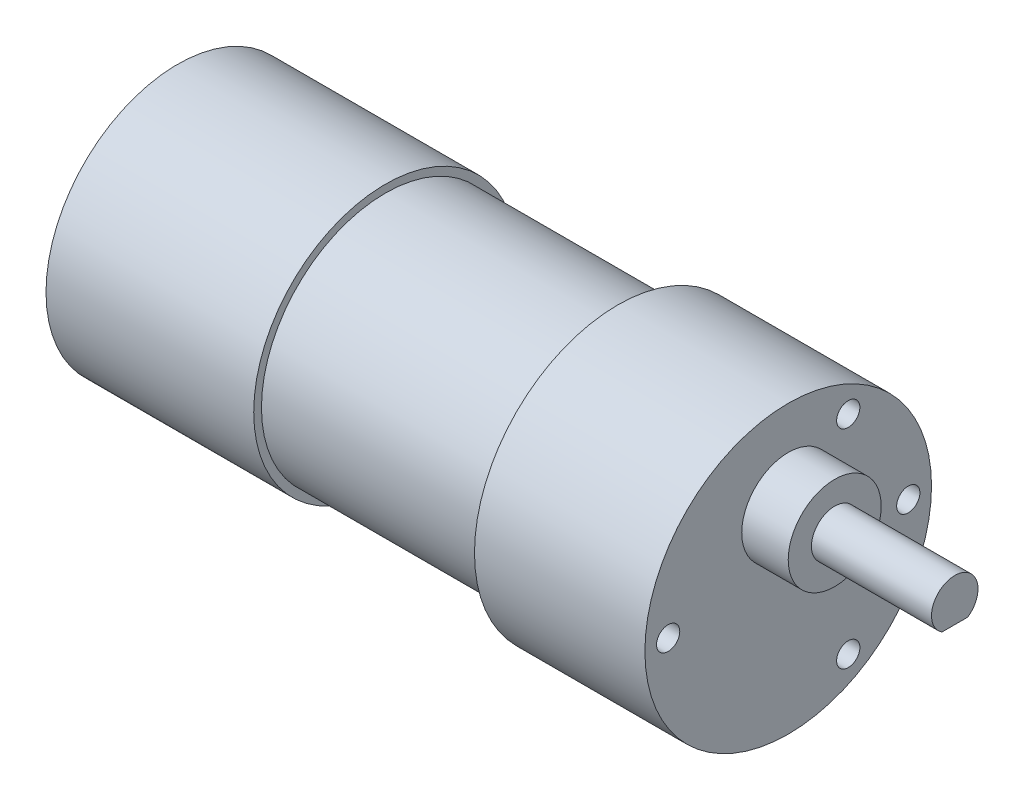
from build123d import *

# Parameters (mm, degrees)
ESQUISSE2_R             = 6
BOSS_EXTRU_1_DEPTH      = 6
ESQUISSE3_R             = 3
BOSS_EXTRU_2_DEPTH      = 15.5
ESQUISSE4_W             = 12
ESQUISSE4_H             = 0.5
ENL_V_MAT_EXTRU_1_DEPTH = 7.75
ESQUISSE5_R             = 1.5
ENL_V_MAT_EXTRU_2_DEPTH = 3.5
ESQUISSE6_W             = 3
ESQUISSE6_H             = 1
BOSS_EXTRU_3_DEPTH      = 4
ESQUISSE7_R             = 17
BOSS_EXTRU_4_DEPTH      = 26.813317369


with BuildPart() as part:
    # Esquisse1 → Révolution1 (revolve)
    with BuildSketch(Plane.XY, mode=Mode.PRIVATE) as r_volution1_sk:
        Polygon((0, 0), (0, 2), (2, 2), (2, 16), (32, 16), (32, 18.5), (54, 18.5), (54, 0), align=None)
    revolve(r_volution1_sk.sketch.rotate(Axis((0, 0, 0), (1, 0, 0)), 90), axis=Axis((0, 0, 0), (1, 0, 0)))

    # Esquisse2 → Boss.-Extru.1 (add)
    with BuildSketch(Plane(origin=(54, 0, 0), x_dir=(0, 0, -1), z_dir=(1, 0, 0))):
        with Locations(Location((0, 7, 0), (0, 0, 180))):
            Circle(ESQUISSE2_R)
    extrude(amount=BOSS_EXTRU_1_DEPTH)

    # Esquisse3 → Boss.-Extru.2 (add)
    with BuildSketch(Plane(origin=(60, 0, 0), x_dir=(0, 0, -1), z_dir=(1, 0, 0))):
        with Locations((0, 7)):
            Circle(ESQUISSE3_R)
    extrude(amount=BOSS_EXTRU_2_DEPTH)

    # Esquisse4 → Enlèv. mat.-Extru.1 (cut, symmetric)
    with BuildSketch(Plane.XY):
        with Locations((69.5, 4.25)):
            Rectangle(ESQUISSE4_W, ESQUISSE4_H)
    extrude(amount=ENL_V_MAT_EXTRU_1_DEPTH, both=True, mode=Mode.SUBTRACT)

    # Esquisse5 → Enlèv. mat.-Extru.2 (cut)
    with BuildSketch(Plane(origin=(54, 0, 0), x_dir=(0, 0, -1), z_dir=(1, 0, 0))):
        with Locations((15.5, 0)):
            Circle(ESQUISSE5_R)
        with Locations((7.75, 13.423393759)):
            Circle(ESQUISSE5_R)
        with Locations((7.75, -13.423393759)):
            Circle(ESQUISSE5_R)
        with Locations((-15.5, 0)):
            Circle(ESQUISSE5_R)
    extrude(amount=-ENL_V_MAT_EXTRU_2_DEPTH, mode=Mode.SUBTRACT)

    # Esquisse6 → Boss.-Extru.3 (add)
    with BuildSketch(Plane.ZY.offset(-2)):
        with Locations((0, 12.939057981)):
            Rectangle(ESQUISSE6_W, ESQUISSE6_H)
        with Locations((0, -12.939057981)):
            Rectangle(ESQUISSE6_W, ESQUISSE6_H)
    extrude(amount=BOSS_EXTRU_3_DEPTH)

    # Esquisse7 → Boss.-Extru.4 (add)
    with BuildSketch(Plane.ZY.offset(-2)):
        Circle(ESQUISSE7_R)
    extrude(amount=BOSS_EXTRU_4_DEPTH)


solid = part.part
